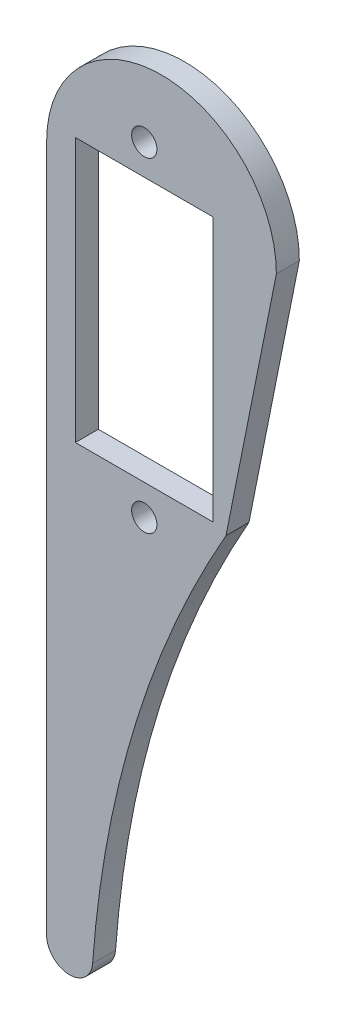
from build123d import *

# Parameters (mm, degrees)
BOSS_EXTRUDE1_DEPTH = 2
CUT_EXTRUDE1_REACH  = 64.284
SKETCH2_R           = 1.1
SKETCH2_W           = 12
SKETCH2_H           = 23


with BuildPart() as part:
    # Sketch1 → Boss-Extrude1 (new body)
    with BuildSketch(Plane.XY):
        with BuildLine():
            Line((-1.783693844, 2.329450915), (-1.783693844, -57.670549085))
            ThreePointArc((-1.783693844, -57.670549085), (0.216306156, -59.527300355), (2.216306156, -57.670549085))
            add(Edge.make_bspline(
                [(13.829397999, -19.605089871), (7.097626367, -31.400579811), (3.226595753, -44.089066216), (2.216306156, -57.670549085)],
                knots=[0, 0, 0, 0, 1, 1, 1, 1], degree=3))
            Line((13.829397999, -19.605089871), (18.216306156, 2.329450915))
            ThreePointArc((18.216306156, 2.329450915), (8.216306156, 12.329450915), (-1.783693844, 2.329450915))
        make_face()
    extrude(amount=BOSS_EXTRUDE1_DEPTH)

    # Sketch2 → Cut-Extrude1 (cut, up to next)
    with BuildSketch(Plane.XY.offset(2), mode=Mode.PRIVATE) as cut_extrude1_sk1:
        with Locations((6.716306156, 6.510600008)):
            Circle(SKETCH2_R)
    cut_extrude1_tool1 = extrude(cut_extrude1_sk1.sketch, amount=-CUT_EXTRUDE1_REACH, mode=Mode.PRIVATE) & part.part
    # Sketch2 → Cut-Extrude1 (cut, up to next)
    with BuildSketch(Plane.XY.offset(2), mode=Mode.PRIVATE) as cut_extrude1_sk2:
        with Locations((6.716306156, -21.789399992)):
            Circle(SKETCH2_R)
    cut_extrude1_tool2 = extrude(cut_extrude1_sk2.sketch, amount=-CUT_EXTRUDE1_REACH, mode=Mode.PRIVATE) & part.part
    # Sketch2 → Cut-Extrude1 (cut, up to next)
    with BuildSketch(Plane.XY.offset(2), mode=Mode.PRIVATE) as cut_extrude1_sk3:
        with Locations((6.716306156, -7.639399992)):
            Rectangle(SKETCH2_W, SKETCH2_H)
    cut_extrude1_tool3 = extrude(cut_extrude1_sk3.sketch, amount=-CUT_EXTRUDE1_REACH, mode=Mode.PRIVATE) & part.part
    add(cut_extrude1_tool1.solids().sort_by_distance((6.716306, 6.5106, 2))[0], mode=Mode.SUBTRACT)
    add(cut_extrude1_tool2.solids().sort_by_distance((6.716306, -21.7894, 2))[0], mode=Mode.SUBTRACT)
    add(cut_extrude1_tool3.solids().sort_by_distance((6.716306, -7.6394, 2))[0], mode=Mode.SUBTRACT)


solid = part.part
